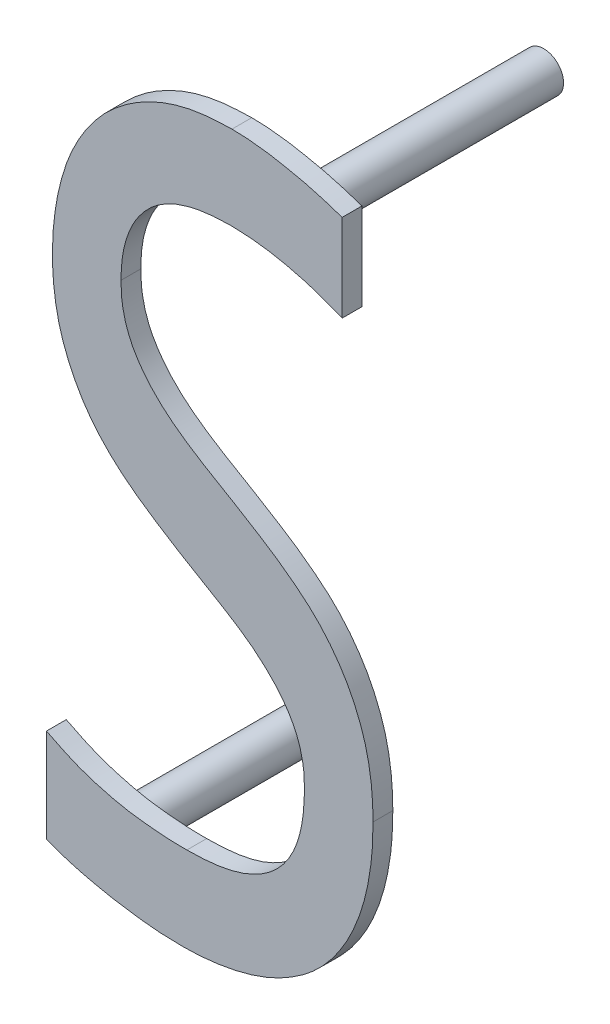
from build123d import *

# Parameters (mm, degrees)
BOSS_EXTRUDE1_DEPTH = 25.4
SKETCH2_R           = 25.4
BOSS_EXTRUDE2_DEPTH = 304.8


with BuildPart() as part:
    # Sketch1 → Boss-Extrude1 (new body)
    with BuildSketch(Plane.XY):
        with BuildLine():
            add(Edge.make_bspline(
                [(471.400045341, 247.723418726), (471.253377656, 237.207919779), (470.967830054, 216.735274463), (467.254101988, 187.082974518), (461.8496739, 159.345276671), (453.870836324, 133.784385037), (444.180642621, 110.205863151), (432.473184544, 88.68343609), (419.069697548, 69.152650509), (403.779500623, 51.811813407), (386.883763515, 36.465486204), (368.07226234, 23.500783632), (347.87819623, 12.143124499), (326.005689501, 3.075456628), (302.798046482, -3.945259965), (278.356817124, -8.845510147), (252.854402734, -12.087794668), (235.433814702, -12.457415416), (226.578825663, -12.645295851)],
                knots=[0, 0, 0, 0, 1.243239104, 2.420464626, 3.5298884, 4.582278609, 5.582746481, 6.541150455, 7.475403342, 8.379003492, 9.270392267, 10.168465759, 11.076013954, 12.006683471, 12.963517291, 13.939882109, 14.95282976, 16, 16, 16, 16], degree=3))
            add(Edge.make_bspline(
                [(226.578825663, -12.645295851), (218.352164012, -12.538505316), (201.941331975, -12.325475825), (177.573248938, -10.221700143), (153.862654705, -6.662758999), (130.879483257, -3.263565991), (109.182795007, 1.737149247), (88.715264824, 6.718897763), (69.935399564, 12.530624018), (58.098073578, 16.817649327), (52.446882793, 18.864293811)],
                knots=[0, 0, 0, 0, 1.110164411, 2.214594747, 3.297432602, 4.346158016, 5.348621489, 6.300893974, 7.188839411, 8, 8, 8, 8], degree=3))
            Line((52.446882793, 18.864293811), (52.446882793, 139.305554296))
            add(Edge.make_bspline(
                [(52.446882793, 139.305554296), (64.874628492, 133.075868175), (90.412266994, 120.274554406), (125.374016113, 109.704702571), (155.301093725, 103.008826714), (179.811466542, 99.962362648), (205.657832859, 97.41723642), (223.461985851, 97.289275944), (232.590523691, 97.223668102)],
                knots=[0, 0, 0, 0, 1.33626015, 2.745866344, 3.501339399, 4.286907587, 5.121663978, 6, 6, 6, 6], degree=3))
            add(Edge.make_bspline(
                [(232.590523691, 97.223668102), (239.158269417, 97.352295207), (251.76305327, 97.599155684), (269.927956029, 99.212302505), (286.582747303, 102.077475814), (301.811701074, 106.180132756), (315.556993667, 111.584001003), (327.916187793, 118.068049642), (339.074197486, 125.536988417), (348.820608618, 134.331311428), (357.487925057, 144.147017107), (364.581237124, 155.14551392), (370.818795453, 166.942817171), (377.159465823, 184.562779609), (382.483224001, 209.282497228), (383.152996334, 229.862905592), (383.504874178, 240.675221038)],
                knots=[0, 0, 0, 0, 1.150469122, 2.207974428, 3.191023612, 4.107189959, 4.965818341, 5.772540898, 6.548058224, 7.311004937, 8.065940222, 8.834721628, 9.59805231, 10.398484715, 12.107874311, 14, 14, 14, 14], degree=3))
            add(Edge.make_bspline(
                [(383.504874178, 240.675221038), (383.375775152, 246.629845256), (383.125140139, 258.190252509), (380.338077986, 274.806688854), (376.07447805, 290.096343088), (367.854208023, 308.522003494), (354.046911722, 329.449339694), (333.034344764, 351.517108283), (308.623384124, 371.497142004), (280.873457154, 389.02389929), (251.61970563, 406.27894442), (221.506803957, 423.847060642), (191.575771198, 442.899613424), (161.963381352, 463.038143438), (134.213750684, 486.282103081), (113.808817585, 508.88596626), (99.373288206, 528.958664647), (89.850872373, 545.572294954), (81.174232028, 563.263750696), (73.576338245, 582.335707349), (67.531929478, 603.000329232), (63.295829594, 625.423786322), (60.478492711, 649.675796329), (60.240534913, 666.460677888), (60.116980277, 675.175878486)],
                knots=[0, 0, 0, 0, 0.683481112, 1.326921685, 1.929962516, 2.50227757, 3.638507422, 4.789972352, 5.991472863, 7.25317922, 8.556146245, 9.89452332, 11.257815158, 12.632065813, 14.006385259, 15.406082955, 16.117620294, 16.843365227, 17.603177928, 18.380093015, 19.199067628, 20.072523982, 20.999198172, 22, 22, 22, 22], degree=3))
            add(Edge.make_bspline(
                [(60.116980277, 675.175878486), (60.266347944, 682.992198254), (60.563202146, 698.526399296), (63.268407253, 721.702673865), (67.029218595, 744.756252708), (72.938939866, 767.448084012), (80.167383133, 789.646297398), (89.804124706, 810.536229263), (101.036631814, 830.225911242), (114.138002232, 848.513903833), (129.090687529, 865.465550925), (146.225980036, 880.584019249), (165.180405766, 894.200695058), (186.25374332, 905.817065987), (209.267887705, 915.423849913), (234.463660866, 922.322523346), (261.770601719, 926.159928277), (280.672245102, 926.743908945), (290.427204715, 927.045295851)],
                knots=[0, 0, 0, 0, 0.975284822, 1.938286936, 2.909635212, 3.888688786, 4.862446742, 5.819714805, 6.754769447, 7.688271271, 8.623047391, 9.570000944, 10.534585516, 11.530702109, 12.567083431, 13.640560543, 14.782315582, 16, 16, 16, 16], degree=3))
            add(Edge.make_bspline(
                [(290.427204715, 927.045295851), (295.821792555, 926.991722181), (307.119137631, 926.879528209), (324.527852683, 924.980301832), (342.762087373, 922.723310686), (361.204928023, 918.9146153), (379.753810568, 915.252650517), (397.872810434, 910.343585066), (415.259940193, 905.344049371), (426.429567097, 901.521556255), (431.805758331, 899.681704829)],
                knots=[0, 0, 0, 0, 0.894821679, 1.873935432, 2.90385038, 3.942982464, 4.997879381, 6.040990772, 7.057085046, 8, 8, 8, 8], degree=3))
            Line((431.805758331, 899.681704829), (431.805758331, 787.739741555))
            add(Edge.make_bspline(
                [(431.805758331, 787.739741555), (419.733337143, 792.567334637), (395.961042108, 802.073544308), (359.459798072, 811.490129789), (323.753844875, 817.963444445), (300.128004953, 818.8267049), (288.561505328, 819.249331217)],
                knots=[0, 0, 0, 0, 1.056204648, 2.079815483, 3.059935496, 4, 4, 4, 4], degree=3))
            add(Edge.make_bspline(
                [(288.561505328, 819.249331217), (282.752570383, 819.122689661), (271.45602877, 818.87641188), (255.109911254, 817.188203241), (239.881672867, 814.614015324), (225.951841889, 810.623314646), (213.116176925, 805.672302763), (201.514790252, 799.441268731), (191.040837515, 792.170464752), (178.867178614, 781.047066068), (166.220178449, 764.674130027), (155.599605332, 741.712519513), (148.992646474, 715.757338896), (148.348308943, 697.398939659), (148.01215144, 687.821174337)],
                knots=[0, 0, 0, 0, 0.952372428, 1.852063221, 2.692205999, 3.481287024, 4.2240212, 4.943845178, 5.635379706, 6.309142243, 7.641770197, 8.995046942, 10.432285145, 12, 12, 12, 12], degree=3))
            add(Edge.make_bspline(
                [(148.01215144, 687.821174337), (148.140595609, 681.866602086), (148.389959273, 670.306295722), (151.197000805, 653.623427204), (155.491262386, 638.151905383), (163.526964206, 619.363875789), (177.574982405, 598.255795043), (198.321298675, 575.633877137), (223.159092318, 555.954749965), (250.598364534, 537.810758968), (280.141752918, 520.983163901), (309.875051442, 502.801163048), (340.136869423, 484.327686063), (369.344089464, 463.38289759), (397.383997281, 440.065868192), (417.599449013, 416.756221958), (431.84436681, 396.186226446), (441.768261809, 379.422271106), (450.322403238, 361.273846123), (457.904994803, 341.861518304), (464.016933769, 320.870667906), (468.213349889, 298.093157172), (471.031668208, 273.498795578), (471.274503264, 256.507607726), (471.400045341, 247.723418726)],
                knots=[0, 0, 0, 0, 0.67806531, 1.316407357, 1.922242701, 2.504478499, 3.638316715, 4.792219623, 5.99029874, 7.239775474, 8.539190492, 9.864250055, 11.212536268, 12.578556635, 13.958200154, 15.359258983, 16.078046046, 16.808815146, 17.576792489, 18.362220191, 19.182266718, 20.064269398, 20.999256344, 22, 22, 22, 22], degree=3))
        make_face()
    extrude(amount=BOSS_EXTRUDE1_DEPTH)

    # Sketch2 → Boss-Extrude2 (add)
    with BuildSketch(Plane(origin=(0, 0, 0), x_dir=(-1, 0, 0), z_dir=(0, 0, -1))):
        with Locations(Location((-360.220944294, 860.84485697, 0), (0, 0, 180))):
            Circle(SKETCH2_R)
        with Locations(Location((-120.389931068, 47.62475465, 0), (0, 0, 180))):
            Circle(SKETCH2_R)
    extrude(amount=BOSS_EXTRUDE2_DEPTH)


solid = part.part
